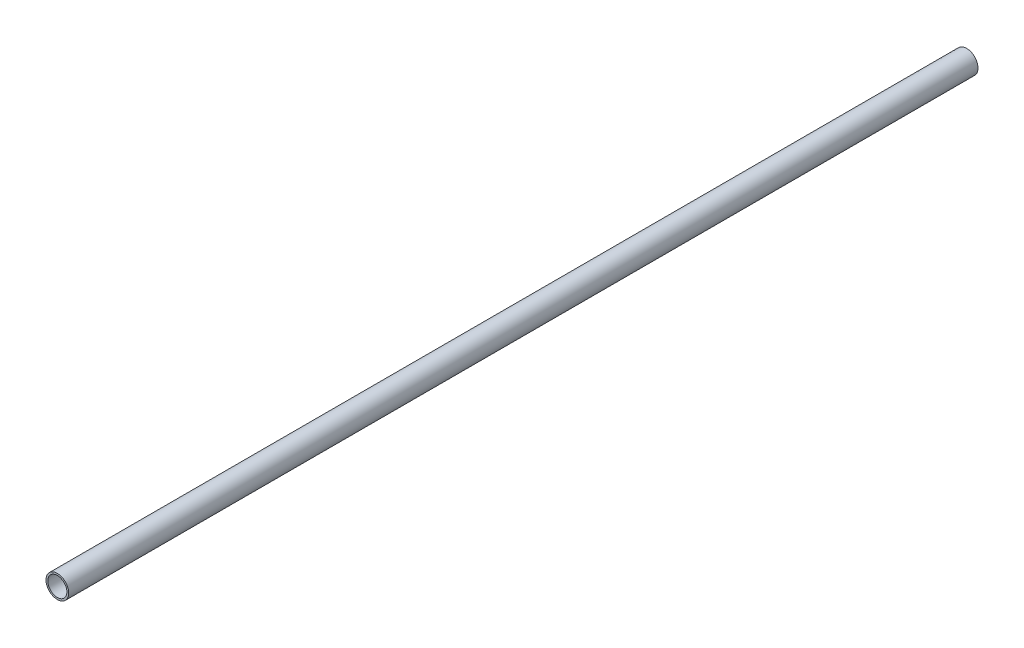
from build123d import *

# Parameters (mm, degrees)
SKETCH1_R           = 12.5
SKETCH1_R_2         = 10.5
BOSS_EXTRUDE1_DEPTH = 1000


with BuildPart() as part:
    # Sketch1 → Boss-Extrude1 (new body)
    with BuildSketch(Plane.XY):
        Circle(SKETCH1_R)
        Circle(SKETCH1_R_2, mode=Mode.SUBTRACT)
    extrude(amount=BOSS_EXTRUDE1_DEPTH)


solid = part.part
